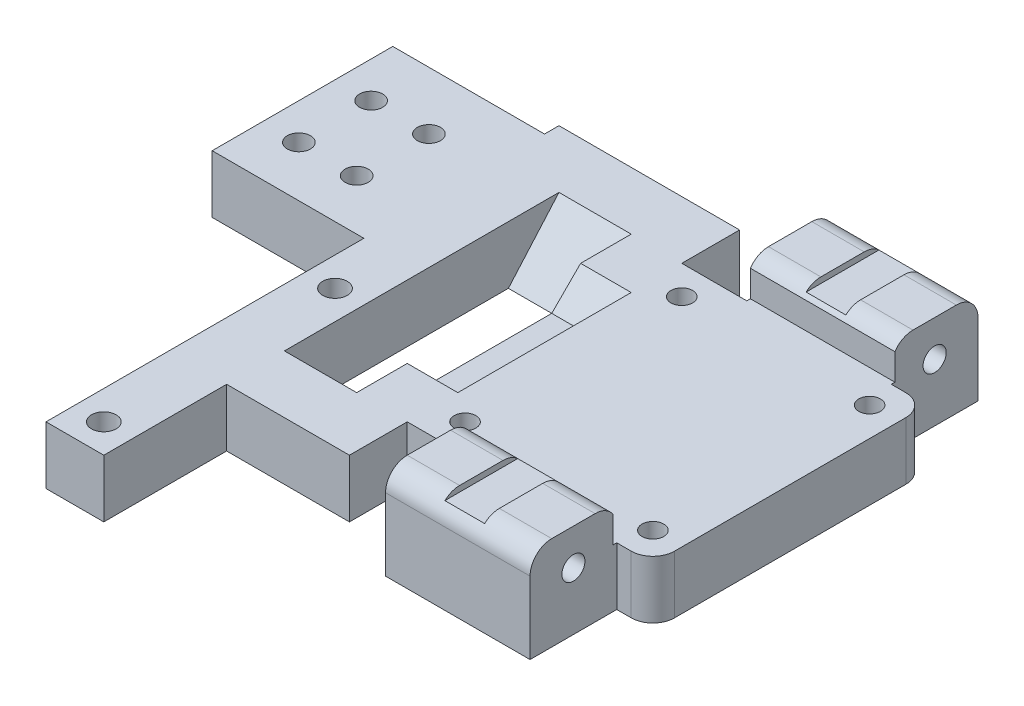
from build123d import *

# Parameters (mm, degrees)
SKETCH1_W            = 300
SKETCH1_H            = 20
BOSS_EXTRUDE1_DEPTH  = 8
SKETCH2_W            = 34
SKETCH2_H            = 8
BOSS_EXTRUDE2_DEPTH  = 9
SKETCH3_W            = 34
SKETCH3_H            = 8
BOSS_EXTRUDE3_DEPTH  = 9
SKETCH4_R            = 1.5
CUT_EXTRUDE1_DEPTH   = 302.504560496
SKETCH5_W            = 25
SKETCH5_H            = 8
BOSS_EXTRUDE4_DEPTH  = 17
SKETCH6_W            = 25
SKETCH6_H            = 8
BOSS_EXTRUDE5_DEPTH  = 17
SKETCH7_W            = 10
SKETCH7_H            = 38
CUT_EXTRUDE2_DEPTH   = 303.37890138
SKETCH8_W            = 7
SKETCH8_H            = 16
CUT_EXTRUDE3_DEPTH   = 4
CUT_EXTRUDE4_DEPTH   = 7
BOSS_EXTRUDE6_DEPTH  = 10
SKETCH12_W           = 8
SKETCH12_H           = 8
BOSS_EXTRUDE7_DEPTH  = 17
SKETCH13_R           = 1.7
CUT_EXTRUDE6_DEPTH   = 305.926220585
SKETCH14_W           = 20
SKETCH14_H           = 13
BOSS_EXTRUDE8_DEPTH  = 12
SKETCH15_R           = 1.6
CUT_EXTRUDE7_DEPTH   = 20
SKETCH16_W           = 20
SKETCH16_H           = 13
BOSS_EXTRUDE9_DEPTH  = 12
SKETCH17_R           = 1.6
CUT_EXTRUDE8_DEPTH   = 20
SKETCH18_W           = 20
SKETCH18_H           = 13
BOSS_EXTRUDE10_DEPTH = 12
CUT_EXTRUDE9_START   = -20
SKETCH19_R           = 1.6
CUT_EXTRUDE9_DEPTH   = 20
SKETCH20_W           = 20
SKETCH20_H           = 13
BOSS_EXTRUDE11_DEPTH = 12
CUT_EXTRUDE10_START  = -20
SKETCH21_R           = 1.6
CUT_EXTRUDE10_DEPTH  = 20
FILLET6_R            = 3
SKETCH28_W           = 198.881436238
SKETCH28_H           = 556.355103816
CUT_EXTRUDE14_DEPTH  = 220
SKETCH29_W           = 21
SKETCH29_H           = 8
BOSS_EXTRUDE12_DEPTH = 15
SKETCH30_W           = 21
SKETCH30_H           = 10
CUT_EXTRUDE15_DEPTH  = 306.0983448
SKETCH31_R           = 1.6
CUT_EXTRUDE16_DEPTH  = 306.0983448
FILLET7_R            = 3
SKETCH32_W           = 5.5
SKETCH32_H           = 70.463459777
CUT_EXTRUDE17_DEPTH  = 0.8
SKETCH33_W           = 20
SKETCH33_H           = 4.963841857
CUT_EXTRUDE18_DEPTH  = 0.5
SKETCH34_W           = 20
SKETCH34_H           = 11.942443484
CUT_EXTRUDE19_DEPTH  = 0.5


with BuildPart() as part:
    # Sketch1 → Boss-Extrude1 (new body)
    with BuildSketch(Plane(origin=(0, 0, 0), x_dir=(1, 0, 0), z_dir=(0, 1, 0))):
        with Locations((150, -10)):
            Rectangle(SKETCH1_W, SKETCH1_H)
    extrude(amount=BOSS_EXTRUDE1_DEPTH)

    # Sketch2 → Boss-Extrude2 (add)
    with BuildSketch(Plane.XY.offset(20)):
        with Locations((17, 4)):
            Rectangle(SKETCH2_W, SKETCH2_H)
        with Locations((283, 4)):
            Rectangle(SKETCH2_W, SKETCH2_H)
    extrude(amount=BOSS_EXTRUDE2_DEPTH)

    # Sketch3 → Boss-Extrude3 (add)
    with BuildSketch(Plane(origin=(0, 0, 0), x_dir=(-1, 0, 0), z_dir=(0, 0, -1))):
        with Locations((-17, 4)):
            Rectangle(SKETCH3_W, SKETCH3_H)
        with Locations((-283, 4)):
            Rectangle(SKETCH3_W, SKETCH3_H)
    extrude(amount=BOSS_EXTRUDE3_DEPTH)

    # Sketch4 → Cut-Extrude1 (cut, through all)
    with BuildSketch(Plane(origin=(0, 8, 0), x_dir=(1, 0, 0), z_dir=(0, 1, 0))):
        with Locations(Location((4, 5, 0), (0, 0, 270))):
            Circle(SKETCH4_R)
        with Locations(Location((30, 5, 0), (0, 0, 270))):
            Circle(SKETCH4_R)
        with Locations(Location((30, -25, 0), (0, 0, 270))):
            Circle(SKETCH4_R)
        with Locations(Location((4, -25, 0), (0, 0, 270))):
            Circle(SKETCH4_R)
        with Locations(Location((296, -25, 0), (0, 0, 270))):
            Circle(SKETCH4_R)
        with Locations(Location((296, 5, 0), (0, 0, 270))):
            Circle(SKETCH4_R)
        with Locations(Location((270, -25, 0), (0, 0, 270))):
            Circle(SKETCH4_R)
        with Locations(Location((270, 5, 0), (0, 0, 270))):
            Circle(SKETCH4_R)
    extrude(amount=-CUT_EXTRUDE1_DEPTH, mode=Mode.SUBTRACT)

    # Sketch5 → Boss-Extrude4 (add)
    with BuildSketch(Plane.XY.offset(20)):
        with Locations((253.5, 4)):
            Rectangle(SKETCH5_W, SKETCH5_H)
    extrude(amount=BOSS_EXTRUDE4_DEPTH)

    # Sketch6 → Boss-Extrude5 (add)
    with BuildSketch(Plane(origin=(0, 0, 0), x_dir=(-1, 0, 0), z_dir=(0, 0, -1))):
        with Locations((-253.5, 4)):
            Rectangle(SKETCH6_W, SKETCH6_H)
    extrude(amount=BOSS_EXTRUDE5_DEPTH)

    # Sketch7 → Cut-Extrude2 (cut, through all)
    with BuildSketch(Plane(origin=(0, 8, 0), x_dir=(1, 0, 0), z_dir=(0, 1, 0))):
        with Locations((254, -10)):
            Rectangle(SKETCH7_W, SKETCH7_H)
    extrude(amount=-CUT_EXTRUDE2_DEPTH, mode=Mode.SUBTRACT)

    # Sketch8 → Cut-Extrude3 (cut)
    with BuildSketch(Plane(origin=(0, 8, 0), x_dir=(1, 0, 0), z_dir=(0, 1, 0))):
        with Locations((262.5, -10)):
            Rectangle(SKETCH8_W, SKETCH8_H)
    extrude(amount=-CUT_EXTRUDE3_DEPTH, mode=Mode.SUBTRACT)

    # Sketch9 → Cut-Extrude4 (cut)
    with BuildSketch(Plane.ZY.offset(-259)):
        Polygon((18, 4), (22, 8), (18, 8), align=None)
        Polygon((2, 4), (-2, 8), (2, 8), align=None)
    extrude(amount=-CUT_EXTRUDE4_DEPTH, mode=Mode.SUBTRACT)

    # Sketch10 → Boss-Extrude6 (add)
    with BuildSketch(Plane.ZY.offset(-259)):
        Polygon((-2, 0), (-9, 8), (-9, 0), align=None)
        Polygon((29, 8), (22, 0), (29, 0), align=None)
    extrude(amount=BOSS_EXTRUDE6_DEPTH)

    # Sketch12 → Boss-Extrude7 (add)
    with BuildSketch(Plane.XY.offset(37)):
        with Locations((245, 4)):
            Rectangle(SKETCH12_W, SKETCH12_H)
    extrude(amount=BOSS_EXTRUDE7_DEPTH)

    # Sketch13 → Cut-Extrude6 (cut, through all)
    with BuildSketch(Plane(origin=(0, 8, 0), x_dir=(1, 0, 0), z_dir=(0, 1, 0))):
        with Locations(Location((245, -50, 0), (0, 0, 270))):
            Circle(SKETCH13_R)
        with Locations(Location((245, -18, 0), (0, 0, 270))):
            Circle(SKETCH13_R)
    extrude(amount=-CUT_EXTRUDE6_DEPTH, mode=Mode.SUBTRACT)

    # Sketch14 → Boss-Extrude8 (add)
    with BuildSketch(Plane.XY.offset(29)):
        with Locations((285, 6.5)):
            Rectangle(SKETCH14_W, SKETCH14_H)
    extrude(amount=BOSS_EXTRUDE8_DEPTH)

    # Sketch15 → Cut-Extrude7 (cut)
    with BuildSketch(Plane(origin=(295, 0, 0), x_dir=(0, 0, -1), z_dir=(1, 0, 0))):
        with Locations((-35, 8)):
            Circle(SKETCH15_R)
    extrude(amount=-CUT_EXTRUDE7_DEPTH, mode=Mode.SUBTRACT)

    # Sketch16 → Boss-Extrude9 (add)
    with BuildSketch(Plane(origin=(0, 0, -9), x_dir=(-1, 0, 0), z_dir=(0, 0, -1))):
        with Locations((-285, 6.5)):
            Rectangle(SKETCH16_W, SKETCH16_H)
    extrude(amount=BOSS_EXTRUDE9_DEPTH)

    # Sketch17 → Cut-Extrude8 (cut)
    with BuildSketch(Plane(origin=(295, 0, 0), x_dir=(0, 0, -1), z_dir=(1, 0, 0))):
        with Locations((15, 8)):
            Circle(SKETCH17_R)
    extrude(amount=-CUT_EXTRUDE8_DEPTH, mode=Mode.SUBTRACT)

    # Sketch18 → Boss-Extrude10 (add)
    with BuildSketch(Plane(origin=(0, 0, -9), x_dir=(-1, 0, 0), z_dir=(0, 0, -1))):
        with Locations((-15, 6.5)):
            Rectangle(SKETCH18_W, SKETCH18_H)
    extrude(amount=BOSS_EXTRUDE10_DEPTH)

    # Sketch19 → Cut-Extrude9 (cut)
    with BuildSketch(Plane.ZY.offset(-5).offset(CUT_EXTRUDE9_START)):
        with Locations(Location((-15, 8, 0), (0, 0, 180))):
            Circle(SKETCH19_R)
    extrude(amount=CUT_EXTRUDE9_DEPTH, mode=Mode.SUBTRACT)

    # Sketch20 → Boss-Extrude11 (add)
    with BuildSketch(Plane.XY.offset(29)):
        with Locations((15, 6.5)):
            Rectangle(SKETCH20_W, SKETCH20_H)
    extrude(amount=BOSS_EXTRUDE11_DEPTH)

    # Sketch21 → Cut-Extrude10 (cut)
    with BuildSketch(Plane.ZY.offset(-5).offset(CUT_EXTRUDE10_START)):
        with Locations(Location((35, 8, 0), (0, 0, 180))):
            Circle(SKETCH21_R)
    extrude(amount=CUT_EXTRUDE10_DEPTH, mode=Mode.SUBTRACT)

    # Fillet6
    fillet6_edges = [part.edges().sort_by_distance(p)[0] for p in [
        (285, 13, 29),
        (285, 13, 41),
        (285, 13, -9),
        (285, 13, -21),
        (15, 13, -9),
        (15, 13, -21),
        (15, 13, 29),
        (15, 13, 41),
    ]]
    fillet(fillet6_edges, radius=FILLET6_R)

    # Sketch28 → Cut-Extrude14 (cut)
    with BuildSketch(Plane.ZY):
        with Locations((-20.495432896, -60.484201615)):
            Rectangle(SKETCH28_W, SKETCH28_H)
    extrude(amount=-CUT_EXTRUDE14_DEPTH, mode=Mode.SUBTRACT)

    # Sketch29 → Boss-Extrude12 (add)
    with BuildSketch(Plane(origin=(0, 0, 0), x_dir=(-1, 0, 0), z_dir=(0, 0, -1))):
        with Locations((-230.5, 4)):
            Rectangle(SKETCH29_W, SKETCH29_H)
    extrude(amount=BOSS_EXTRUDE12_DEPTH)

    # Sketch30 → Cut-Extrude15 (cut, through all)
    with BuildSketch(Plane(origin=(0, 0, 0), x_dir=(-1, 0, 0), z_dir=(0, -1, 0))):
        with Locations((-230.5, -15)):
            Rectangle(SKETCH30_W, SKETCH30_H)
    extrude(amount=-CUT_EXTRUDE15_DEPTH, mode=Mode.SUBTRACT)

    # Sketch31 → Cut-Extrude16 (cut, through all)
    with BuildSketch(Plane(origin=(0, 0, 0), x_dir=(-1, 0, 0), z_dir=(0, -1, 0))):
        with Locations(Location((-225, 7, 0), (0, 0, 90))):
            Circle(SKETCH31_R)
        with Locations(Location((-225, -3, 0), (0, 0, 90))):
            Circle(SKETCH31_R)
        with Locations(Location((-233, 7, 0), (0, 0, 90))):
            Circle(SKETCH31_R)
        with Locations(Location((-233, -3, 0), (0, 0, 90))):
            Circle(SKETCH31_R)
    extrude(amount=-CUT_EXTRUDE16_DEPTH, mode=Mode.SUBTRACT)

    # Fillet7
    fillet7_edges = [part.edges().sort_by_distance(p)[0] for p in [
        (300, 4, 29),
        (300, 4, -9),
    ]]
    fillet(fillet7_edges, radius=FILLET7_R)

    # Sketch32 → Cut-Extrude17 (cut)
    with BuildSketch(Plane(origin=(0, 13, 0), x_dir=(1, 0, 0), z_dir=(0, 1, 0))):
        with Locations((285, -7.2213573)):
            Rectangle(SKETCH32_W, SKETCH32_H)
    extrude(amount=-CUT_EXTRUDE17_DEPTH, mode=Mode.SUBTRACT)

    # Sketch33 → Cut-Extrude18 (cut)
    with BuildSketch(Plane(origin=(0, 0, 29), x_dir=(-1, 0, 0), z_dir=(0, 0, -1))):
        with Locations((-285, 10.481920928)):
            Rectangle(SKETCH33_W, SKETCH33_H)
    extrude(amount=-CUT_EXTRUDE18_DEPTH, mode=Mode.SUBTRACT)

    # Sketch34 → Cut-Extrude19 (cut)
    with BuildSketch(Plane.XY.offset(-9)):
        with Locations((285, 13.971221742)):
            Rectangle(SKETCH34_W, SKETCH34_H)
    extrude(amount=-CUT_EXTRUDE19_DEPTH, mode=Mode.SUBTRACT)


solid = part.part
